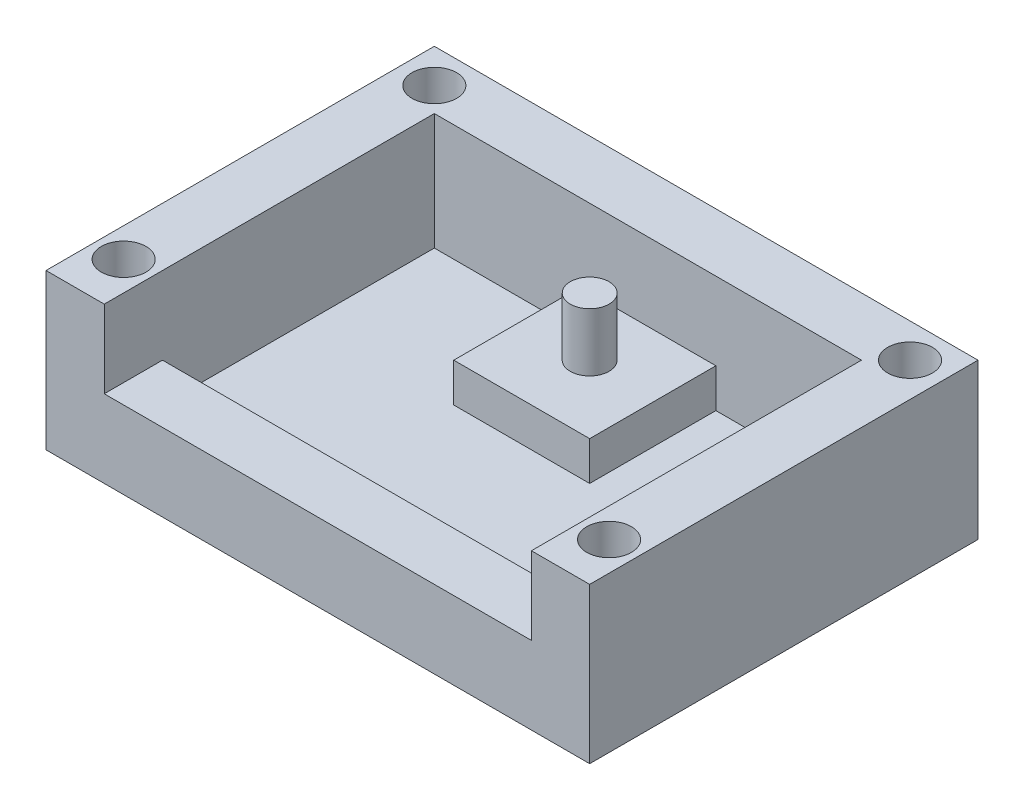
from build123d import *

# Parameters (mm, degrees)
ESQUISSE3_W             = 28
ESQUISSE3_H             = 20
BOSS_EXTRU_1_DEPTH      = 8
ESQUISSE4_W             = 22
ESQUISSE4_H             = 14
ENL_V_MAT_EXTRU_1_DEPTH = 6
ESQUISSE5_W             = 22
ESQUISSE5_H             = 3
ENL_V_MAT_EXTRU_2_DEPTH = 4
ESQUISSE7_R             = 1
BOSS_EXTRU_2_DEPTH      = 5
ESQUISSE9_R             = 1.15
ENL_V_MAT_EXTRU_3_DEPTH = 2
ESQUISSE11_R            = 1.15
ENL_V_MAT_EXTRU_4_DEPTH = 2
ESQUISSE12_W            = 7
ESQUISSE12_H            = 6.5
BOSS_EXTRU_3_DEPTH      = 2


with BuildPart() as part:
    # Esquisse3 → Boss.-Extru.1 (new body)
    with BuildSketch(Plane(origin=(0, 0, 0), x_dir=(1, 0, 0), z_dir=(0, 1, 0))):
        with Locations((-14, -10)):
            Rectangle(ESQUISSE3_W, ESQUISSE3_H)
    extrude(amount=BOSS_EXTRU_1_DEPTH)

    # Esquisse4 → Enlèv. mat.-Extru.1 (cut)
    with BuildSketch(Plane(origin=(0, 8, 0), x_dir=(1, 0, 0), z_dir=(0, 1, 0))):
        with Locations((-14, -10)):
            Rectangle(ESQUISSE4_W, ESQUISSE4_H)
    extrude(amount=-ENL_V_MAT_EXTRU_1_DEPTH, mode=Mode.SUBTRACT)

    # Esquisse5 → Enlèv. mat.-Extru.2 (cut)
    with BuildSketch(Plane(origin=(0, 8, 0), x_dir=(1, 0, 0), z_dir=(0, 1, 0))):
        with Locations((-14, -18.5)):
            Rectangle(ESQUISSE5_W, ESQUISSE5_H)
    extrude(amount=-ENL_V_MAT_EXTRU_2_DEPTH, mode=Mode.SUBTRACT)

    # Esquisse7 → Boss.-Extru.2 (add)
    with BuildSketch(Plane(origin=(0, 2, 0), x_dir=(1, 0, 0), z_dir=(0, 1, 0))):
        with Locations(Location((-14, -6, 0), (0, 0, 270))):
            Circle(ESQUISSE7_R)
    extrude(amount=BOSS_EXTRU_2_DEPTH)

    # Esquisse9 → Enlèv. mat.-Extru.3 (cut)
    with BuildSketch(Plane(origin=(0, 8, 0), x_dir=(1, 0, 0), z_dir=(0, 1, 0))):
        with Locations(Location((-26.25, -1.75, 0), (0, 0, 270))):
            Circle(ESQUISSE9_R)
    enl_v_mat_extru_3 = extrude(amount=-ENL_V_MAT_EXTRU_3_DEPTH, mode=Mode.SUBTRACT)

    # Symétrie1: Enlèv. mat.-Extru.3 across plane
    add(enl_v_mat_extru_3.mirror(Plane.ZY.offset(14)), mode=Mode.SUBTRACT)

    # Esquisse11 → Enlèv. mat.-Extru.4 (cut)
    with BuildSketch(Plane(origin=(0, 8, 0), x_dir=(1, 0, 0), z_dir=(0, 1, 0))):
        with Locations(Location((-26.5, -17.5, 0), (0, 0, 270))):
            Circle(ESQUISSE11_R)
    enl_v_mat_extru_4 = extrude(amount=-ENL_V_MAT_EXTRU_4_DEPTH, mode=Mode.SUBTRACT)

    # Symétrie2: Enlèv. mat.-Extru.4 across plane
    add(enl_v_mat_extru_4.mirror(Plane.ZY.offset(14)), mode=Mode.SUBTRACT)

    # Esquisse12 → Boss.-Extru.3 (add)
    with BuildSketch(Plane(origin=(0, 2, 0), x_dir=(1, 0, 0), z_dir=(0, 1, 0))):
        with Locations((-14, -6.25)):
            Rectangle(ESQUISSE12_W, ESQUISSE12_H)
    extrude(amount=BOSS_EXTRU_3_DEPTH)


solid = part.part
